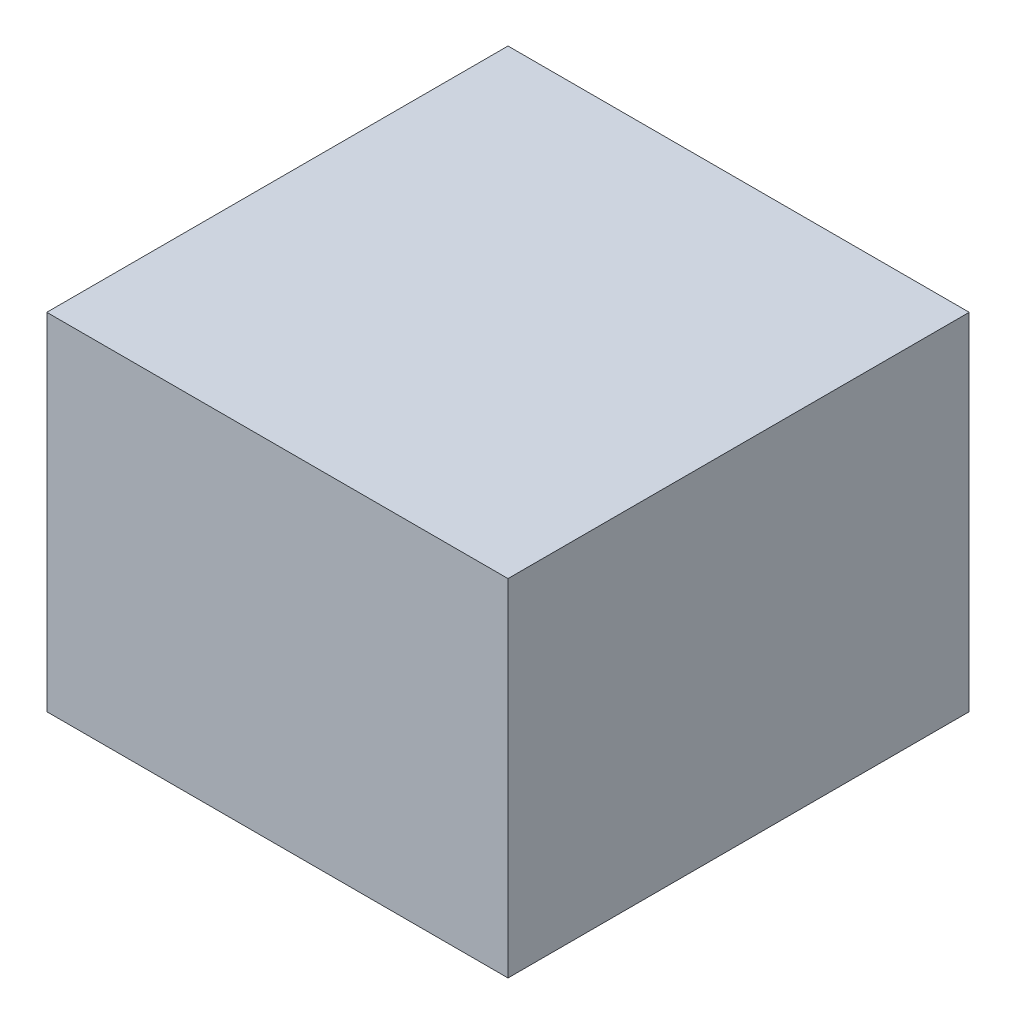
from build123d import *

# Parameters (mm, degrees)
PACK_VAKUM_SENSORU_1_START = -640
SKETCH1_W                  = 40
SKETCH1_H                  = 30
PACK_VAKUM_SENSORU_1_DEPTH = 40


with BuildPart() as part:
    # Sketch1 → PACK_vakum_sensoru_1 (new body)
    with BuildSketch(Plane.XY.offset(PACK_VAKUM_SENSORU_1_START)):
        with Locations((320, 335)):
            Rectangle(SKETCH1_W, SKETCH1_H)
    extrude(amount=-PACK_VAKUM_SENSORU_1_DEPTH)


solid = part.part
